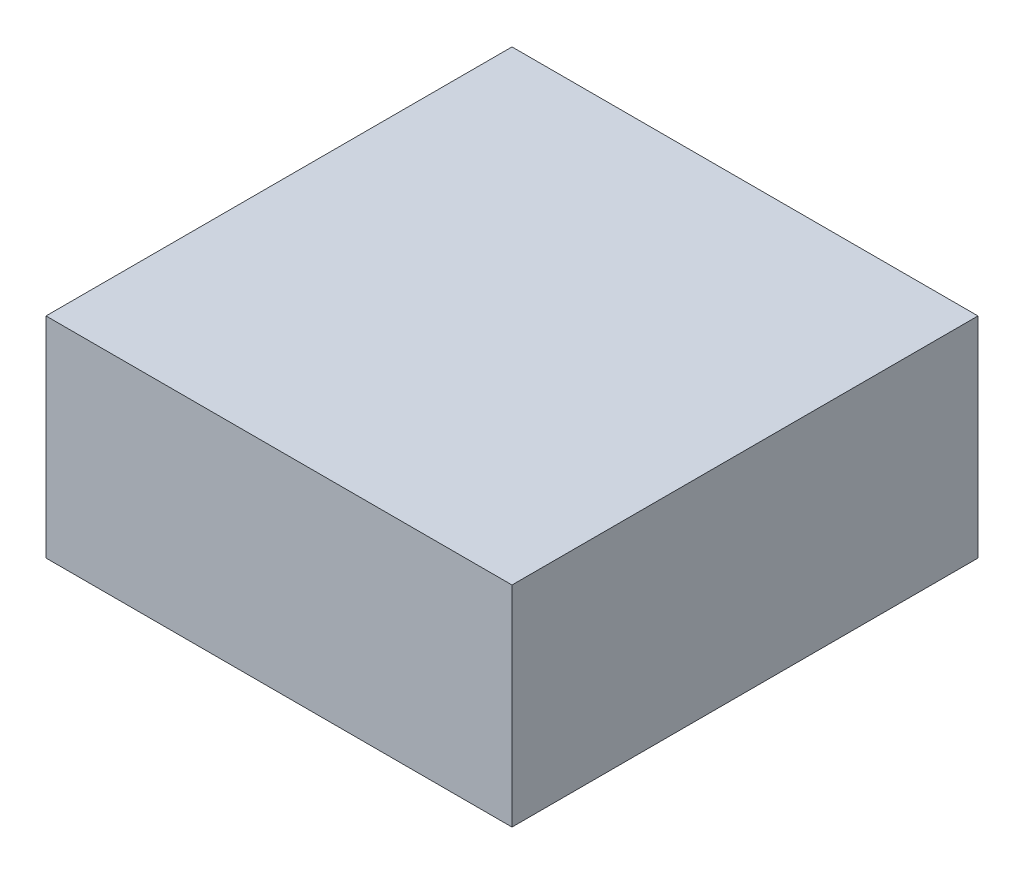
from build123d import *

# Parameters (mm, degrees)
ESBO_O1_W                = 20
ESBO_O1_H                = 20
RESSALTO_EXTRUS_O1_DEPTH = 9


with BuildPart() as part:
    # Esboço1 → Ressalto-extrusão1 (new body)
    with BuildSketch(Plane(origin=(0, 0, 0), x_dir=(1, 0, 0), z_dir=(0, 1, 0))):
        with Locations((-12.867531092, 1.812427071)):
            Rectangle(ESBO_O1_W, ESBO_O1_H)
    extrude(amount=RESSALTO_EXTRUS_O1_DEPTH)


solid = part.part
